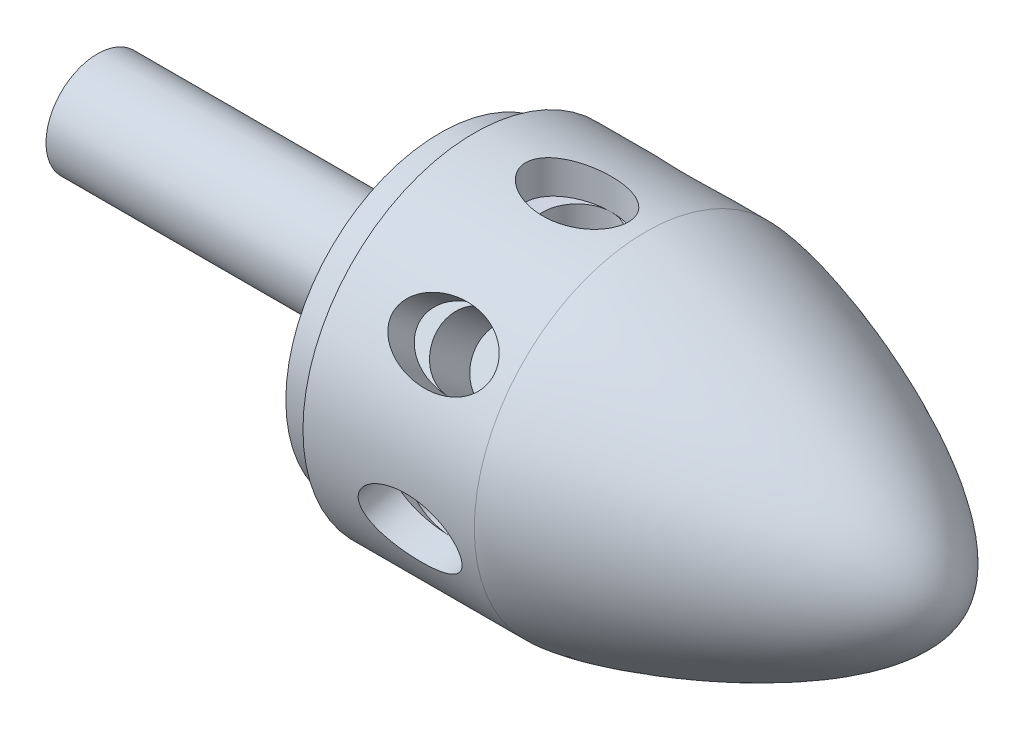
from build123d import *

# Parameters (mm, degrees)
SKETCH2_RX         = 15
SKETCH2_RY         = 10
CUT_EXTRUDE1_DEPTH = 10
SKETCH3_R          = 10
CUT_EXTRUDE2_DEPTH = 15
CIRPATTERN1_COUNT  = 7


with BuildPart() as part:
    # Sketch1 → Revolve1 (revolve)
    with BuildSketch(Plane.XY, mode=Mode.PRIVATE) as revolve1_sk:
        with BuildLine():
            Line((0, 0), (150, 0))
            add(Edge.make_bspline(
                [(60, 50), (76.666666667, 50), (150, 25), (150, 0)],
                knots=[0, 0, 0, 0, 1, 1, 1, 1], degree=3))
            Line((60, 50), (10, 50))
            Line((10, 50), (10, 45))
            Line((10, 45), (0, 45))
            Line((0, 45), (0, 15))
            Line((0, 15), (-100, 15))
            Line((-100, 15), (-100, 0))
            Line((-100, 0), (0, 0))
        make_face()
    revolve(revolve1_sk.sketch.rotate(Axis((0, 0, 0), (1, 0, 0)), 90), axis=Axis((0, 0, 0), (1, 0, 0)))

    # Sketch2 → Cut-Extrude1 (cut)
    with BuildSketch(Plane(origin=(0, 50, 0), x_dir=(1, 0, 0), z_dir=(0, 1, 0))):
        with Locations(Location((40, 0), (0, 0, 180))):
            Ellipse(SKETCH2_RX, SKETCH2_RY)
    cut_extrude1 = extrude(amount=-CUT_EXTRUDE1_DEPTH, mode=Mode.SUBTRACT)

    # Sketch3 → Cut-Extrude2 (cut)
    with BuildSketch(Plane(origin=(0, 40, 0), x_dir=(1, 0, 0), z_dir=(0, 1, 0))):
        with Locations(Location((40, 0, 0), (0, 0, 270))):
            Circle(SKETCH3_R)
    cut_extrude2 = extrude(amount=-CUT_EXTRUDE2_DEPTH, mode=Mode.SUBTRACT)

    # CirPattern1: Cut-Extrude1, Cut-Extrude2 ×7 about axis
    cirpattern1_axis = Axis((0, 0, 0), (-1, 0, 0))
    add([cut_extrude1.rotate(cirpattern1_axis, i * 360 / CIRPATTERN1_COUNT) for i in range(1, CIRPATTERN1_COUNT)], mode=Mode.SUBTRACT)
    add([cut_extrude2.rotate(cirpattern1_axis, i * 360 / CIRPATTERN1_COUNT) for i in range(1, CIRPATTERN1_COUNT)], mode=Mode.SUBTRACT)


solid = part.part
